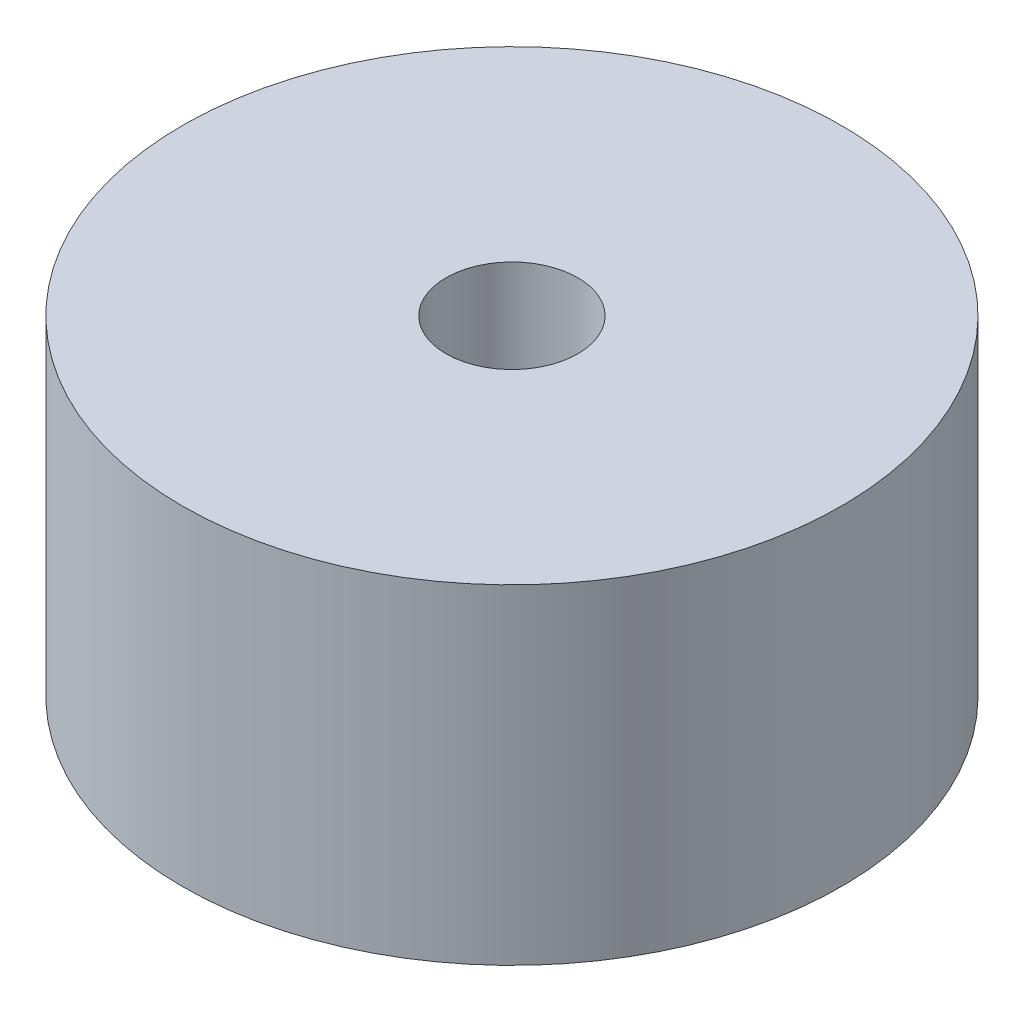
from build123d import *

# Parameters (mm, degrees)
SKETCH1_R           = 2.5
SKETCH1_R_2         = 0.5
BOSS_EXTRUDE1_DEPTH = 2.5


with BuildPart() as part:
    # Sketch1 → Boss-Extrude1 (new body)
    with BuildSketch(Plane(origin=(0, 0, 0), x_dir=(1, 0, 0), z_dir=(0, 1, 0))):
        with Locations(Location((0, 0, 0), (0, 0, 270))):
            Circle(SKETCH1_R)
        with Locations(Location((0, 0, 0), (0, 0, 270))):
            Circle(SKETCH1_R_2, mode=Mode.SUBTRACT)
    extrude(amount=BOSS_EXTRUDE1_DEPTH)


solid = part.part
